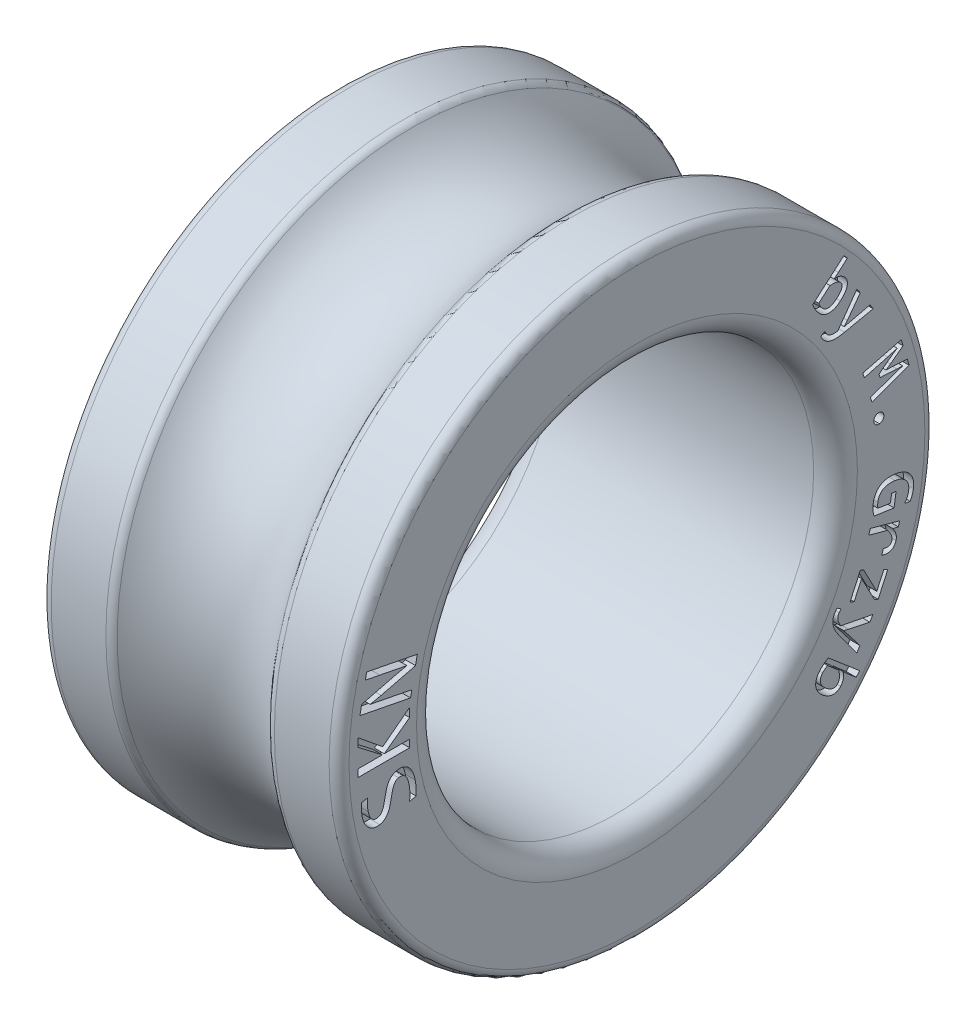
from build123d import *

# Parameters (mm, degrees)
FILLET1_R          = 1.1
FILLET2_R          = 0.5
FILLET3_R          = 0.5
CUT_EXTRUDE1_DEPTH = 0.5


with BuildPart() as part:
    # Sketch2 → Revolve1 (revolve)
    with BuildSketch(Plane(origin=(0, 0, 0), x_dir=(-1, 0, 0), z_dir=(0, 1, 0)), mode=Mode.PRIVATE) as revolve1_sk:
        with BuildLine():
            Line((-7.5, 15), (-7.5, 10))
            Line((-7.5, 10), (7.5, 10))
            Line((7.5, 10), (7.5, 15))
            Line((7.5, 15), (4, 15))
            ThreePointArc((4, 15), (0, 13), (-4, 15))
            Line((-4, 15), (-7.5, 15))
        make_face()
    revolve(revolve1_sk.sketch.rotate(Axis((14.358974359, 0, 0), (-1, 0, 0)), 180), axis=Axis((14.358974359, 0, 0), (-1, 0, 0)))

    # Fillet1
    fillet1_edges = [part.edges().sort_by_distance(p)[0] for p in [
        (-7.5, 0, 10),
        (7.5, 0, 10),
    ]]
    fillet(fillet1_edges, radius=FILLET1_R)

    # Fillet2
    fillet2_edges = [part.edges().sort_by_distance(p)[0] for p in [
        (-7.5, 0, 15),
        (7.5, 0, 15),
    ]]
    fillet(fillet2_edges, radius=FILLET2_R)

    # Fillet3
    fillet3_edges = [part.edges().sort_by_distance(p)[0] for p in [
        (4, 0, 15),
        (-4, 0, 15),
    ]]
    fillet(fillet3_edges, radius=FILLET3_R)

    # Sketch3 → Cut-Extrude1 (cut)
    # profile 1 of 12: a face of its own
    with BuildSketch(Plane.YZ.offset(7.5)):
        Polygon((3.076089788, 11.060643242), (2.623915875, 11.149547228), (2.191760078, 12.884646865), (2.078127831, 13.438088894), (1.826135078, 12.152808097), (1.66599015, 11.337364257), (1.342167686, 11.400951213), (1.842031817, 13.949728387), (2.288906817, 13.862001938), (2.701044498, 12.21757259), (2.842348846, 11.584646865), (3.110238338, 12.950000126), (3.252131454, 13.673007373), (3.575953918, 13.609420416), align=None)
    # profile 2 of 12: a face of its own
    with BuildSketch(Plane.YZ.offset(7.5)):
        Polygon((0.954928279, 11.446259467), (0.509819584, 11.446259467), (-0.432209402, 12.721531206), (-0.432209402, 11.446259467), (-0.809020996, 11.446259467), (-0.809020996, 14.046259467), (-0.432209402, 14.046259467), (-0.432209402, 12.819855481), (0.509819584, 14.046259467), (0.929022482, 14.046259467), (-0.08601375, 12.801603669), align=None)
    # profile 3 of 12: a face of its own
    with BuildSketch(Plane.YZ.offset(7.5)):
        with BuildLine():
            add(Edge.make_bspline(
                [(-1.479036237, 12.09199008), (-1.474231129, 12.062431483), (-1.464885598, 12.004942494), (-1.462556946, 11.919292862), (-1.47051932, 11.837274942), (-1.489843349, 11.759318587), (-1.517370348, 11.685222277), (-1.554434516, 11.615847461), (-1.599510651, 11.550698939), (-1.652728988, 11.489741424), (-1.714575897, 11.433830013), (-1.783894216, 11.381733355), (-1.8611857, 11.334127557), (-1.946060584, 11.291481292), (-2.037542379, 11.253104921), (-2.135331816, 11.220146202), (-2.238626546, 11.189910512), (-2.310253355, 11.175164605), (-2.34688044, 11.167624138)],
                knots=[0, 0, 0, 0, 1.005354078, 1.955329294, 2.870042248, 3.765730629, 4.646387396, 5.519580731, 6.401273885, 7.303276056, 8.2321656, 9.197602241, 10.213284686, 11.277945232, 12.386332483, 13.543757598, 14.743975884, 16, 16, 16, 16], degree=3))
            add(Edge.make_bspline(
                [(-2.34688044, 11.167624138), (-2.380791732, 11.161484778), (-2.448626962, 11.149203768), (-2.550210747, 11.135437133), (-2.649977204, 11.124932924), (-2.746174972, 11.117267459), (-2.838255235, 11.112398238), (-2.925237081, 11.110824798), (-3.005944515, 11.111048292), (-3.057332126, 11.113482475), (-3.081663049, 11.114635007)],
                knots=[0, 0, 0, 0, 1.120109665, 2.240637081, 3.33119982, 4.380705617, 5.377202028, 6.327927445, 7.208309769, 8, 8, 8, 8], degree=3))
            Line((-3.081663049, 11.114635007), (-3.147605078, 11.450232833))
            add(Edge.make_bspline(
                [(-3.147605078, 11.450232833), (-3.120953177, 11.44617891), (-3.066256165, 11.437859146), (-2.981865072, 11.431417692), (-2.893492717, 11.427814003), (-2.800968556, 11.427752188), (-2.703442174, 11.432204093), (-2.600865711, 11.44373943), (-2.492635058, 11.457589723), (-2.419232137, 11.471800396), (-2.381617759, 11.479082471)],
                knots=[0, 0, 0, 0, 0.839293667, 1.722460789, 2.63387489, 3.593446296, 4.603097706, 5.672247013, 6.807173082, 8, 8, 8, 8], degree=3))
            add(Edge.make_bspline(
                [(-2.381617759, 11.479082471), (-2.35468072, 11.484747057), (-2.302912411, 11.495633405), (-2.229104195, 11.514884759), (-2.162514049, 11.536679172), (-2.102416619, 11.560203199), (-2.048863594, 11.58597577), (-2.001153456, 11.613854976), (-1.959307723, 11.643545447), (-1.923457235, 11.675826428), (-1.893127864, 11.709691604), (-1.869433689, 11.746251138), (-1.850788527, 11.784076197), (-1.838283105, 11.82422948), (-1.831709823, 11.86606624), (-1.828360315, 11.909633298), (-1.830935044, 11.955076859), (-1.836119254, 11.98566086), (-1.838773556, 12.00131979)],
                knots=[0, 0, 0, 0, 1.543551753, 2.966438237, 4.275089847, 5.47069963, 6.583178451, 7.604368112, 8.566497703, 9.454922339, 10.304954346, 11.107790061, 11.890456177, 12.663231979, 13.455741403, 14.261062801, 15.109668579, 16, 16, 16, 16], degree=3))
            add(Edge.make_bspline(
                [(-1.838773556, 12.00131979), (-1.842514806, 12.017793625), (-1.849843966, 12.050066093), (-1.870325605, 12.09428083), (-1.896587648, 12.133849734), (-1.930223466, 12.167058608), (-1.968371325, 12.196796567), (-2.011015859, 12.222806426), (-2.05699635, 12.247646328), (-2.126352215, 12.274574255), (-2.220638225, 12.305998331), (-2.34342117, 12.331214562), (-2.472918765, 12.355285504), (-2.605826882, 12.380677719), (-2.739537056, 12.409179978), (-2.871262705, 12.441598524), (-2.997555149, 12.482369966), (-3.094819702, 12.529717355), (-3.166348713, 12.574283564), (-3.215271085, 12.613012908), (-3.260758032, 12.655374809), (-3.302563995, 12.702224774), (-3.339568227, 12.754749643), (-3.369361643, 12.814440044), (-3.393992814, 12.880082312), (-3.404299338, 12.926895413), (-3.409606889, 12.951002761)],
                knots=[0, 0, 0, 0, 0.617308121, 1.20931499, 1.773609048, 2.34806975, 2.931945175, 3.542349197, 4.175855008, 4.843366422, 6.264300034, 7.811379333, 9.428627203, 11.090947313, 12.767508624, 14.436174882, 16.059403867, 17.618811613, 18.384687985, 19.142593504, 19.900464926, 20.659290502, 21.43907723, 22.246093665, 23.096790682, 24, 24, 24, 24], degree=3))
            add(Edge.make_bspline(
                [(-3.409606889, 12.951002761), (-3.413240106, 12.972927221), (-3.42050441, 13.01676329), (-3.422536931, 13.083760182), (-3.417558201, 13.151338814), (-3.406670774, 13.219504157), (-3.387998363, 13.287230057), (-3.360501395, 13.353161169), (-3.324797741, 13.417029128), (-3.281196461, 13.47913589), (-3.228225962, 13.538348188), (-3.166152944, 13.594250783), (-3.094873446, 13.646584531), (-3.015062356, 13.696334652), (-2.925577518, 13.741938879), (-2.825094164, 13.780255557), (-2.715260826, 13.814187626), (-2.6376945, 13.830469144), (-2.597695658, 13.83886508)],
                knots=[0, 0, 0, 0, 0.790859942, 1.581256354, 2.380108088, 3.201785735, 4.036209735, 4.876120354, 5.739752446, 6.637697424, 7.573481636, 8.563291511, 9.607654368, 10.719108943, 11.910187897, 13.178437449, 14.544997031, 16, 16, 16, 16], degree=3))
            add(Edge.make_bspline(
                [(-2.597695658, 13.83886508), (-2.575357982, 13.84301495), (-2.528890287, 13.85164767), (-2.456302696, 13.86048739), (-2.380128864, 13.868018852), (-2.302012549, 13.87407383), (-2.22346152, 13.877379642), (-2.145926071, 13.879152287), (-2.071322334, 13.879323709), (-2.022859558, 13.877846713), (-1.999507252, 13.877135007)],
                knots=[0, 0, 0, 0, 0.907778726, 1.888396373, 2.920900302, 3.966988251, 5.019028008, 6.062436884, 7.0663645, 8, 8, 8, 8], degree=3))
            Line((-1.999507252, 13.877135007), (-1.938275368, 13.565087906))
            add(Edge.make_bspline(
                [(-1.938275368, 13.565087906), (-1.990849317, 13.568537075), (-2.095341242, 13.575392378), (-2.250551145, 13.573230775), (-2.401184758, 13.561735422), (-2.498683309, 13.545020137), (-2.546472832, 13.536827036)],
                knots=[0, 0, 0, 0, 1.034977525, 2.057041456, 3.047646745, 4, 4, 4, 4], degree=3))
            add(Edge.make_bspline(
                [(-2.546472832, 13.536827036), (-2.570458909, 13.531718486), (-2.616888169, 13.52182999), (-2.683441418, 13.50440757), (-2.744128842, 13.484356631), (-2.799462152, 13.462518434), (-2.849455377, 13.438683793), (-2.893968146, 13.412266052), (-2.932419903, 13.383173198), (-2.965782958, 13.35257613), (-2.993486564, 13.319903556), (-3.016921248, 13.286144172), (-3.035028369, 13.250802032), (-3.048926574, 13.21434136), (-3.057965491, 13.176540053), (-3.060986066, 13.137330135), (-3.060995366, 13.096968932), (-3.056355892, 13.070092402), (-3.053990947, 13.056392254)],
                knots=[0, 0, 0, 0, 1.49761663, 2.898899606, 4.198929802, 5.398561653, 6.529655968, 7.577962258, 8.553587863, 9.469521267, 10.336631543, 11.164414849, 11.973860158, 12.755221533, 13.543082541, 14.337389998, 15.152494596, 16, 16, 16, 16], degree=3))
            add(Edge.make_bspline(
                [(-3.053990947, 13.056392254), (-3.050012978, 13.039927432), (-3.042231672, 13.007720589), (-3.021738484, 12.963314207), (-2.995593746, 12.923329869), (-2.961966621, 12.88924287), (-2.923318637, 12.859618707), (-2.881211205, 12.831987591), (-2.834517172, 12.808348585), (-2.766121148, 12.778365537), (-2.670835648, 12.748910621), (-2.548138409, 12.721936827), (-2.418224173, 12.69850826), (-2.285204576, 12.67278335), (-2.151511609, 12.644789917), (-2.041348594, 12.616262209), (-1.954876455, 12.590618847), (-1.89321563, 12.56602844), (-1.834008224, 12.539171364), (-1.777993906, 12.508365815), (-1.724598948, 12.474382962), (-1.674939907, 12.435499918), (-1.629692386, 12.391469361), (-1.587313371, 12.343990004), (-1.550396878, 12.290398676), (-1.519545078, 12.230346986), (-1.495532257, 12.163535494), (-1.484632534, 12.116261955), (-1.479036237, 12.09199008)],
                knots=[0, 0, 0, 0, 0.666922642, 1.304567585, 1.918791052, 2.543084426, 3.182841637, 3.837926488, 4.52713315, 5.244976567, 6.782817839, 8.450870497, 10.200400576, 11.990869688, 13.79667786, 15.588402355, 16.479937145, 17.352780828, 18.205118492, 19.043733327, 19.872820386, 20.700024964, 21.526975804, 22.361038078, 23.20730418, 24.086956499, 25.017777067, 26, 26, 26, 26], degree=3))
        make_face()
    # profile 4 of 12: a face of its own
    with BuildSketch(Plane.YZ.offset(7.5)):
        with BuildLine():
            add(Edge.make_bspline(
                [(-8.888469786, -9.325566238), (-8.867822522, -9.302450582), (-8.827460027, -9.257262726), (-8.762659856, -9.196425103), (-8.695879745, -9.144105481), (-8.627640301, -9.099870162), (-8.558494592, -9.063643912), (-8.488679838, -9.035037304), (-8.418139497, -9.01510464), (-8.347260269, -9.002834281), (-8.276013283, -8.9979234), (-8.204768025, -9.002373773), (-8.13352165, -9.014125886), (-8.062608146, -9.034235586), (-7.992330562, -9.062602022), (-7.922654826, -9.098452037), (-7.85442928, -9.14303494), (-7.8116164, -9.178111974), (-7.789737902, -9.196037253)],
                knots=[0, 0, 0, 0, 1.188467682, 2.323287128, 3.404060307, 4.438462617, 5.438247551, 6.39420826, 7.327233931, 8.244017327, 9.149224409, 10.059860676, 10.975674289, 11.914271917, 12.880976054, 13.878091017, 14.915649195, 16, 16, 16, 16], degree=3))
            add(Edge.make_bspline(
                [(-7.789737902, -9.196037253), (-7.772674255, -9.210965184), (-7.738252045, -9.241079049), (-7.689011733, -9.289787411), (-7.640884129, -9.341272703), (-7.595045684, -9.39615965), (-7.550242259, -9.453071329), (-7.508876821, -9.51324594), (-7.470053814, -9.57591612), (-7.446814998, -9.619366762), (-7.435118337, -9.641236528)],
                knots=[0, 0, 0, 0, 0.949935675, 1.916289299, 2.901146672, 3.902389062, 4.912289178, 5.935439551, 6.960856474, 8, 8, 8, 8], degree=3))
            Line((-7.435118337, -9.641236528), (-8.777509641, -11.212794499))
            Line((-8.777509641, -11.212794499), (-8.979502395, -11.040240151))
            Line((-8.979502395, -11.040240151), (-8.593632829, -10.588700296))
            Line((-8.593632829, -10.588700296), (-8.39979225, -10.380819862))
            add(Edge.make_bspline(
                [(-8.39979225, -10.380819862), (-8.429884136, -10.386929983), (-8.487892082, -10.398708426), (-8.573318855, -10.404847366), (-8.653058878, -10.402289448), (-8.727272236, -10.389048936), (-8.796548802, -10.366258561), (-8.861997792, -10.336057287), (-8.924753923, -10.299152662), (-8.962647153, -10.268545754), (-8.981766887, -10.25310247)],
                knots=[0, 0, 0, 0, 1.186754452, 2.287699361, 3.304667345, 4.265773362, 5.192868662, 6.117938489, 7.050370874, 8, 8, 8, 8], degree=3))
            add(Edge.make_bspline(
                [(-8.981766887, -10.25310247), (-8.997565203, -10.238848876), (-9.028352085, -10.211072262), (-9.066840864, -10.163796575), (-9.098758088, -10.114694334), (-9.122423425, -10.062554345), (-9.138593494, -10.008232374), (-9.148758747, -9.952186153), (-9.151855527, -9.89438228), (-9.147961734, -9.835187935), (-9.138018339, -9.77459477), (-9.120837933, -9.712866001), (-9.097812852, -9.649717426), (-9.067468476, -9.585976442), (-9.031650666, -9.520977042), (-8.989582312, -9.455735339), (-8.941682996, -9.390042399), (-8.906512101, -9.347427336), (-8.888469786, -9.325566238)],
                knots=[0, 0, 0, 0, 0.972617281, 1.895382556, 2.780945736, 3.646743955, 4.50581576, 5.369211779, 6.248091163, 7.148067299, 8.079561543, 9.053454324, 10.07652809, 11.152265553, 12.281128319, 13.471424138, 14.702866093, 16, 16, 16, 16], degree=3))
        make_face()
        with BuildLine():
            add(Edge.make_bspline(
                [(-8.673795873, -9.492685804), (-8.698192994, -9.52246456), (-8.745182647, -9.579819418), (-8.795256058, -9.655629194), (-8.82827836, -9.714717511), (-8.847992123, -9.757248781), (-8.863455554, -9.798699148), (-8.874488995, -9.839164437), (-8.880979696, -9.878320312), (-8.882903692, -9.916324629), (-8.880191016, -9.953141473), (-8.873077913, -9.988727313), (-8.860710283, -10.022696079), (-8.842924038, -10.054834099), (-8.818805065, -10.084441972), (-8.79991782, -10.102199839), (-8.7901908, -10.111345224)],
                knots=[0, 0, 0, 0, 2.294896032, 4.420044701, 5.407390264, 6.329919037, 7.213027755, 8.042992118, 8.827513412, 9.575697517, 10.307004766, 11.023925705, 11.73317274, 12.454658845, 13.204142069, 14, 14, 14, 14], degree=3))
            add(Edge.make_bspline(
                [(-8.7901908, -10.111345224), (-8.776730761, -10.121722942), (-8.749345794, -10.142836808), (-8.701583902, -10.167578257), (-8.646640114, -10.185795353), (-8.583218906, -10.196847551), (-8.510612726, -10.200403117), (-8.444038045, -10.197547908), (-8.385484244, -10.191718026), (-8.337196045, -10.184730873), (-8.285654802, -10.176210226), (-8.250463857, -10.168985613), (-8.232219786, -10.165240151)],
                knots=[0, 0, 0, 0, 0.877292611, 1.784885566, 2.764633516, 3.859128106, 5.101965261, 6.515562194, 7.299863911, 8.143067262, 9.037308806, 10, 10, 10, 10], degree=3))
            Line((-8.232219786, -10.165240151), (-7.749429931, -9.60002276))
            add(Edge.make_bspline(
                [(-7.749429931, -9.60002276), (-7.763021205, -9.575733814), (-7.790062015, -9.527409222), (-7.838046558, -9.460792096), (-7.887706303, -9.398694774), (-7.926050291, -9.363773142), (-7.944629206, -9.34685247)],
                knots=[0, 0, 0, 0, 1.038471894, 2.066113899, 3.062968996, 4, 4, 4, 4], degree=3))
            add(Edge.make_bspline(
                [(-7.944629206, -9.34685247), (-7.956390575, -9.337269391), (-7.979650901, -9.318317043), (-8.017168853, -9.293995442), (-8.055715235, -9.272356479), (-8.096067915, -9.254841581), (-8.137686202, -9.240642654), (-8.181067008, -9.233337518), (-8.225574081, -9.230374677), (-8.271309006, -9.23336558), (-8.318467208, -9.241234601), (-8.36621589, -9.256907854), (-8.415523817, -9.277722967), (-8.465767516, -9.305687629), (-8.517394685, -9.340333517), (-8.569586566, -9.383200671), (-8.621975546, -9.434830639), (-8.656042263, -9.472864662), (-8.673795873, -9.492685804)],
                knots=[0, 0, 0, 0, 0.861035411, 1.702859944, 2.535641307, 3.368775692, 4.198461696, 5.025929639, 5.85919637, 6.726696229, 7.623201269, 8.566885821, 9.573371663, 10.659327884, 11.826934319, 13.10042467, 14.488908446, 16, 16, 16, 16], degree=3))
        make_face(mode=Mode.SUBTRACT)
    # profile 5 of 12: a face of its own
    with BuildSketch(Plane.YZ.offset(7.5)):
        with BuildLine():
            Line((-7.932062101, -11.071026213), (-6.748638188, -10.19693201))
            add(Edge.make_bspline(
                [(-6.748638188, -10.19693201), (-6.719020026, -10.175773177), (-6.661565581, -10.134728461), (-6.575980602, -10.07788716), (-6.49349925, -10.028101209), (-6.414478574, -9.984316386), (-6.338355716, -9.946537803), (-6.263701941, -9.916768336), (-6.191406418, -9.892732855), (-6.12055557, -9.876431564), (-6.051504559, -9.866149446), (-5.983829159, -9.862908554), (-5.917511515, -9.866539139), (-5.852360442, -9.876936303), (-5.787944446, -9.894731557), (-5.723313112, -9.91794755), (-5.659374648, -9.949686147), (-5.618021728, -9.974850299), (-5.596917174, -9.98769288)],
                knots=[0, 0, 0, 0, 1.387223393, 2.690989091, 3.914564467, 5.057971361, 6.133587738, 7.150738081, 8.118726475, 9.034286176, 9.917959616, 10.776204553, 11.611758001, 12.445109619, 13.28532526, 14.15540756, 15.058608164, 16, 16, 16, 16], degree=3))
            add(Edge.make_bspline(
                [(-5.596917174, -9.98769288), (-5.586281089, -9.994537016), (-5.56616814, -10.00747935), (-5.537658678, -10.028102993), (-5.509072213, -10.047834985), (-5.490287448, -10.061901951), (-5.480522246, -10.069214619)],
                knots=[0, 0, 0, 0, 1.067608886, 2.018859582, 2.970110278, 4, 4, 4, 4], degree=3))
            Line((-5.480522246, -10.069214619), (-5.611409927, -10.273018967))
            add(Edge.make_bspline(
                [(-5.611409927, -10.273018967), (-5.620420116, -10.265410976), (-5.639285629, -10.249481382), (-5.669580105, -10.225945889), (-5.701773164, -10.200397079), (-5.725542509, -10.185249008), (-5.737768623, -10.177457373)],
                knots=[0, 0, 0, 0, 0.89235037, 1.868401166, 2.90358056, 4, 4, 4, 4], degree=3))
            add(Edge.make_bspline(
                [(-5.737768623, -10.177457373), (-5.758258035, -10.165604544), (-5.798403074, -10.142381218), (-5.853194561, -10.123279203), (-5.897740141, -10.11503588), (-5.931959518, -10.110902438), (-5.967312725, -10.111941984), (-6.003801759, -10.11496491), (-6.04156993, -10.121309922), (-6.080636741, -10.131643079), (-6.121337437, -10.14449467), (-6.16312688, -10.161766441), (-6.206714276, -10.181426935), (-6.251619302, -10.205656221), (-6.299287222, -10.23177065), (-6.330736945, -10.252128572), (-6.346917174, -10.2626023)],
                knots=[0, 0, 0, 0, 1.514996234, 2.968342133, 3.687488783, 4.41723069, 5.171943309, 5.948901249, 6.763270276, 7.622114559, 8.536952921, 9.49634105, 10.518051183, 11.599966249, 12.765232469, 14, 14, 14, 14], degree=3))
            Line((-6.346917174, -10.2626023), (-6.661228768, -11.887149402))
            Line((-6.661228768, -11.887149402), (-6.916210652, -11.723653025))
            Line((-6.916210652, -11.723653025), (-6.693837464, -10.658435633))
            Line((-6.693837464, -10.658435633), (-6.630431667, -10.415229112))
            Line((-6.630431667, -10.415229112), (-6.837406304, -10.573290706))
            Line((-6.837406304, -10.573290706), (-7.686138188, -11.229087807))
            Line((-7.686138188, -11.229087807), (-7.932062101, -11.071026213))
        make_face()
    # profile 6 of 12: a face of its own
    with BuildSketch(Plane.YZ.offset(7.5)):
        Polygon((-5.539583362, -10.733649602), (-4.417300754, -11.247236559), (-4.496558, -11.420696704), (-5.748822493, -12.077399602), (-4.981612348, -12.428848878), (-5.074003652, -12.63129453), (-6.13106887, -12.147145979), (-6.044565246, -11.958287283), (-4.814492783, -11.312001052), (-5.632880464, -10.93745395), align=None)
    # profile 7 of 12: a face of its own
    with BuildSketch(Plane.YZ.offset(7.5)):
        with BuildLine():
            Line((-3.248763058, -13.225294846), (-3.482911609, -13.16143615))
            Line((-3.482911609, -13.16143615), (-3.415429725, -12.886979628))
            add(Edge.make_bspline(
                [(-3.415429725, -12.886979628), (-3.443642967, -12.906070004), (-3.497608219, -12.942585373), (-3.580377859, -12.98693082), (-3.65889159, -13.022260077), (-3.734930471, -13.045450902), (-3.807833713, -13.059550811), (-3.878414927, -13.064137303), (-3.947062306, -13.060071536), (-3.991010294, -13.050023682), (-4.012802913, -13.045041222)],
                knots=[0, 0, 0, 0, 1.279256544, 2.446914854, 3.524066501, 4.509225291, 5.427146246, 6.308288098, 7.161125794, 8, 8, 8, 8], degree=3))
            add(Edge.make_bspline(
                [(-4.012802913, -13.045041222), (-4.031340718, -13.039502602), (-4.067324808, -13.028751479), (-4.117848984, -13.007308222), (-4.163531621, -12.98228396), (-4.204768267, -12.953684285), (-4.240983959, -12.920989466), (-4.272783117, -12.8847738), (-4.299573356, -12.844739469), (-4.321445301, -12.800899791), (-4.338107354, -12.753557753), (-4.350025837, -12.702869211), (-4.356217887, -12.648628074), (-4.35685938, -12.59101582), (-4.352653233, -12.530155479), (-4.34348364, -12.465971375), (-4.328842612, -12.398395552), (-4.315756963, -12.352640111), (-4.308998565, -12.329008614)],
                knots=[0, 0, 0, 0, 1.044753591, 2.027991381, 2.958916226, 3.855026381, 4.732946556, 5.58852843, 6.452737719, 7.328229341, 8.228635634, 9.158559331, 10.135926182, 11.171982401, 12.267471115, 13.429108118, 14.672201105, 16, 16, 16, 16], degree=3))
            Line((-4.308998565, -12.329008614), (-4.049940594, -12.400113686))
            add(Edge.make_bspline(
                [(-4.049940594, -12.400113686), (-4.054297658, -12.415780387), (-4.062678453, -12.445915222), (-4.072743395, -12.490177395), (-4.080102312, -12.531562593), (-4.08438484, -12.570304355), (-4.085206534, -12.606193425), (-4.083759073, -12.639285718), (-4.078601728, -12.669620707), (-4.068796915, -12.705705301), (-4.049085189, -12.746134725), (-4.013807947, -12.785506892), (-3.96904968, -12.816874517), (-3.933819818, -12.828120211), (-3.915429725, -12.833990498)],
                knots=[0, 0, 0, 0, 1.131095061, 2.175656805, 3.156339143, 4.053995159, 4.883915354, 5.651708032, 6.354397847, 7.019429471, 8.249951985, 9.440430811, 10.663897183, 12, 12, 12, 12], degree=3))
            add(Edge.make_bspline(
                [(-3.915429725, -12.833990498), (-3.897847423, -12.837744028), (-3.862069488, -12.845382024), (-3.804964354, -12.845991936), (-3.744511762, -12.835897503), (-3.679690577, -12.815096905), (-3.609855475, -12.783741326), (-3.548721465, -12.749625207), (-3.49571254, -12.718301166), (-3.453619543, -12.689895004), (-3.408681935, -12.659661709), (-3.378810155, -12.637554389), (-3.363346391, -12.626110063)],
                knots=[0, 0, 0, 0, 0.883480663, 1.797780165, 2.791187763, 3.888988412, 5.140185976, 6.553700325, 7.333778147, 8.170701322, 9.053024511, 10, 10, 10, 10], degree=3))
            Line((-3.363346391, -12.626110063), (-3.103382623, -11.676834701))
            Line((-3.103382623, -11.676834701), (-2.844324652, -11.747486875))
            Line((-2.844324652, -11.747486875), (-3.248763058, -13.225294846))
        make_face()
    # profile 8 of 12: a face of its own
    with BuildSketch(Plane.YZ.offset(7.5)):
        with BuildLine():
            add(Edge.make_bspline(
                [(-2.618856113, -13.484750807), (-2.601776787, -13.497018722), (-2.56778538, -13.521434421), (-2.514850314, -13.554421167), (-2.46052928, -13.583804953), (-2.405330459, -13.611116552), (-2.347150525, -13.633589506), (-2.286366039, -13.653422595), (-2.222036907, -13.668518339), (-2.177925902, -13.676101737), (-2.155540895, -13.679950082)],
                knots=[0, 0, 0, 0, 0.993042256, 1.976360423, 2.943201891, 3.909491052, 4.882700715, 5.886158404, 6.927289077, 8, 8, 8, 8], degree=3))
            add(Edge.make_bspline(
                [(-2.155540895, -13.679950082), (-2.129919515, -13.683263523), (-2.079868312, -13.689736307), (-2.005592496, -13.689220439), (-1.934630195, -13.682416057), (-1.867157395, -13.667313369), (-1.803368447, -13.645006349), (-1.743595352, -13.615958782), (-1.687569791, -13.580730924), (-1.635819171, -13.538844023), (-1.588210165, -13.490516554), (-1.54451491, -13.436451607), (-1.505589439, -13.37616476), (-1.470672128, -13.310429845), (-1.440654438, -13.239230283), (-1.414489749, -13.163603749), (-1.394800699, -13.082986985), (-1.385419023, -13.02753909), (-1.380631475, -12.999243561)],
                knots=[0, 0, 0, 0, 1.063613668, 2.077762476, 3.05345057, 3.996885387, 4.919744257, 5.832459311, 6.730056373, 7.641498166, 8.569794029, 9.521074254, 10.501274864, 11.522745043, 12.584792564, 13.682684101, 14.817454096, 16, 16, 16, 16], degree=3))
            add(Edge.make_bspline(
                [(-1.380631475, -12.999243561), (-1.376690364, -12.969689363), (-1.369007981, -12.91207954), (-1.363072916, -12.827241862), (-1.362445468, -12.746448449), (-1.367350388, -12.669693378), (-1.377485898, -12.597209109), (-1.393631922, -12.529109954), (-1.416470201, -12.466092617), (-1.444395873, -12.407416063), (-1.479305203, -12.353999685), (-1.519927111, -12.305329478), (-1.567528963, -12.262235397), (-1.621115894, -12.224121554), (-1.681409096, -12.191287996), (-1.748635535, -12.164608366), (-1.82276705, -12.143804941), (-1.874946177, -12.134790718), (-1.901917707, -12.130131242)],
                knots=[0, 0, 0, 0, 1.234091966, 2.405608139, 3.518073827, 4.57650954, 5.586741639, 6.544742672, 7.467945432, 8.356811324, 9.228752071, 10.102572195, 10.974064874, 11.879302321, 12.819005814, 13.808948611, 14.867439676, 16, 16, 16, 16], degree=3))
            add(Edge.make_bspline(
                [(-1.901917707, -12.130131242), (-1.912020572, -12.128794561), (-1.932929636, -12.126028145), (-1.965168011, -12.12433001), (-1.998506167, -12.121939389), (-2.032204252, -12.122454458), (-2.065629276, -12.122820214), (-2.09772537, -12.126108018), (-2.127952544, -12.128508336), (-2.146960872, -12.132371514), (-2.155993794, -12.134207329)],
                knots=[0, 0, 0, 0, 0.958126896, 1.982955847, 3.035255606, 4.100220937, 5.151370432, 6.177280892, 7.133828197, 8, 8, 8, 8], degree=3))
            Line((-2.155993794, -12.134207329), (-2.248837997, -12.764189213))
            Line((-2.248837997, -12.764189213), (-1.84485249, -12.823971822))
            Line((-1.84485249, -12.823971822), (-1.877914084, -13.046797909))
            Line((-1.877914084, -13.046797909), (-2.548656837, -12.947613126))
            Line((-2.548656837, -12.947613126), (-2.399200316, -11.935837764))
            add(Edge.make_bspline(
                [(-2.399200316, -11.935837764), (-2.376788077, -11.929458082), (-2.331269977, -11.916501277), (-2.260567714, -11.903225608), (-2.188140048, -11.891866166), (-2.114425458, -11.886001024), (-2.040979097, -11.883000921), (-1.968416105, -11.884547735), (-1.897659765, -11.889299525), (-1.851320007, -11.895298984), (-1.828548142, -11.898247184)],
                knots=[0, 0, 0, 0, 0.970060632, 1.970143041, 2.993670812, 4.02236172, 5.047973285, 6.054204042, 7.043814511, 8, 8, 8, 8], degree=3))
            add(Edge.make_bspline(
                [(-1.828548142, -11.898247184), (-1.795665471, -11.9038543), (-1.731244047, -11.914839368), (-1.638734243, -11.940816806), (-1.552399019, -11.973952925), (-1.472487278, -12.014398518), (-1.398759107, -12.061224621), (-1.332600109, -12.115786994), (-1.273250351, -12.17653777), (-1.221957251, -12.244648192), (-1.177644322, -12.319143791), (-1.140806038, -12.400291228), (-1.112993392, -12.488769317), (-1.092221819, -12.583312634), (-1.079420089, -12.684559787), (-1.076350751, -12.791992229), (-1.081161367, -12.905710285), (-1.091095374, -12.982994493), (-1.096211185, -13.022794285)],
                knots=[0, 0, 0, 0, 1.049748317, 2.056593381, 3.019680091, 3.957170563, 4.872255732, 5.763904387, 6.651361925, 7.540269537, 8.441897387, 9.375826067, 10.339417063, 11.356666186, 12.420292152, 13.547501122, 14.73701307, 16, 16, 16, 16], degree=3))
            add(Edge.make_bspline(
                [(-1.096211185, -13.022794285), (-1.102794026, -13.062334928), (-1.115640517, -13.139498954), (-1.145574776, -13.25025598), (-1.181887458, -13.353908337), (-1.226944145, -13.449308582), (-1.277975823, -13.537065988), (-1.33535905, -13.616385664), (-1.398398014, -13.687515212), (-1.467591586, -13.749849381), (-1.542012615, -13.803468837), (-1.621601719, -13.848287513), (-1.706186322, -13.884231219), (-1.795704963, -13.910749941), (-1.889150757, -13.928743704), (-1.986305391, -13.935703253), (-2.086588139, -13.935636987), (-2.153933214, -13.927060969), (-2.188149591, -13.922703706)],
                knots=[0, 0, 0, 0, 1.204172083, 2.349955907, 3.443599505, 4.501178953, 5.515997248, 6.490808177, 7.438903646, 8.367425576, 9.284198181, 10.19035362, 11.107317105, 12.04045101, 12.991798439, 13.961378261, 14.964226425, 16, 16, 16, 16], degree=3))
            add(Edge.make_bspline(
                [(-2.188149591, -13.922703706), (-2.210068482, -13.919094978), (-2.25331618, -13.911974675), (-2.317060193, -13.898527598), (-2.378564603, -13.881461978), (-2.438474006, -13.86276861), (-2.496334726, -13.840526801), (-2.552088248, -13.814397547), (-2.606496492, -13.785822471), (-2.641040376, -13.763829056), (-2.658258287, -13.752866749)],
                knots=[0, 0, 0, 0, 1.057963274, 2.087444834, 3.100856563, 4.096850046, 5.07561712, 6.050361557, 7.028230267, 8, 8, 8, 8], degree=3))
            Line((-2.658258287, -13.752866749), (-2.618856113, -13.484750807))
        make_face()
    # profile 9 of 12: a face of its own
    with BuildSketch(Plane.YZ.offset(7.5)):
        with BuildLine():
            add(Edge.make_bspline(
                [(1.779107263, -12.430910787), (1.762189544, -12.432576609), (1.728483026, -12.435895558), (1.678437199, -12.427356311), (1.631440289, -12.410857052), (1.589240854, -12.385139196), (1.553161201, -12.351416706), (1.52305455, -12.311558991), (1.500616952, -12.265261448), (1.493681146, -12.231549716), (1.490157988, -12.21442528)],
                knots=[0, 0, 0, 0, 1.013365303, 2.019008306, 3.007829723, 3.98092352, 4.952758192, 5.946602592, 6.956942616, 8, 8, 8, 8], degree=3))
            add(Edge.make_bspline(
                [(1.490157988, -12.21442528), (1.488486729, -12.19750859), (1.485171672, -12.163953163), (1.493681597, -12.114181502), (1.51029445, -12.067777326), (1.535541836, -12.025719327), (1.569165216, -11.989957443), (1.608680942, -11.959832879), (1.653994756, -11.936809334), (1.687236024, -11.930168827), (1.703926103, -11.9268347)],
                knots=[0, 0, 0, 0, 1.022277578, 2.027758429, 3.01670331, 3.985835469, 4.966217166, 5.961525656, 6.976504216, 8, 8, 8, 8], degree=3))
            add(Edge.make_bspline(
                [(1.703926103, -11.9268347), (1.721305963, -11.925086261), (1.755359331, -11.921660441), (1.805468705, -11.930959079), (1.851982866, -11.947339994), (1.893654331, -11.972746891), (1.930068247, -12.005348438), (1.959690607, -12.044877092), (1.983011329, -12.089851278), (1.989569388, -12.122990943), (1.992875379, -12.139697019)],
                knots=[0, 0, 0, 0, 1.048495575, 2.054378315, 3.042298904, 4.010427292, 4.977527578, 5.971805185, 6.977564294, 8, 8, 8, 8], degree=3))
            add(Edge.make_bspline(
                [(1.992875379, -12.139697019), (1.994549448, -12.157065486), (1.997855979, -12.191370736), (1.989435458, -12.242055365), (1.972663867, -12.28916467), (1.947582621, -12.331602355), (1.91492458, -12.368491573), (1.875308019, -12.398386657), (1.829578424, -12.42100998), (1.796095217, -12.427578301), (1.779107263, -12.430910787)],
                knots=[0, 0, 0, 0, 1.039475837, 2.053115987, 3.041028338, 4.01632358, 4.981836865, 5.967561147, 6.968827039, 8, 8, 8, 8], degree=3))
        make_face()
    # profile 10 of 12: a face of its own
    with BuildSketch(Plane.YZ.offset(7.5)):
        Polygon((2.619746415, -11.831475686), (2.873369603, -11.753577135), (3.274637719, -12.93020757), (3.43043482, -13.381747425), (3.438134096, -13.089174961), (3.487500038, -12.244972063), (3.666847864, -12.190171338), (4.157789893, -12.837363367), (4.337137719, -13.104573512), (4.196739168, -12.625859744), (3.873822502, -11.447870614), (4.118387719, -11.373142353), (4.607518154, -13.307019164), (4.300000038, -13.401222063), (3.82445656, -12.762182208), (3.666847864, -12.545696701), (3.660960183, -12.812001048), (3.610688444, -13.611819889), (3.294112357, -13.70828728), align=None)
    # profile 11 of 12: a face of its own
    with BuildSketch(Plane.YZ.offset(7.5)):
        with BuildLine():
            Line((6.665643697, -11.895312616), (6.362654567, -10.456001022))
            add(Edge.make_bspline(
                [(6.362654567, -10.456001022), (6.355559882, -10.420275156), (6.341801918, -10.350995795), (6.326736477, -10.249378137), (6.315057965, -10.153664618), (6.308100617, -10.063457645), (6.30595581, -9.978314598), (6.309637375, -9.897977296), (6.317955631, -9.82224153), (6.331846696, -9.750912952), (6.352050121, -9.684214699), (6.376725367, -9.621160548), (6.40778019, -9.562523156), (6.444372185, -9.50761093), (6.486908296, -9.456073424), (6.53554978, -9.407512255), (6.590601461, -9.362078144), (6.630688246, -9.334907023), (6.651150944, -9.321037254)],
                knots=[0, 0, 0, 0, 1.387617387, 2.690858346, 3.913052682, 5.060978894, 6.136878051, 7.156049006, 8.122856157, 9.037738274, 9.920370897, 10.774890353, 11.613699817, 12.4432875, 13.285109139, 14.155530226, 15.058472097, 16, 16, 16, 16], degree=3))
            add(Edge.make_bspline(
                [(6.651150944, -9.321037254), (6.661841543, -9.314348976), (6.682058406, -9.301700853), (6.712290479, -9.283787415), (6.742497393, -9.266590925), (6.763148911, -9.255332818), (6.773886451, -9.249479283)],
                knots=[0, 0, 0, 0, 1.064874406, 2.013771049, 2.967281063, 4, 4, 4, 4], degree=3))
            Line((6.773886451, -9.249479283), (6.904774132, -9.453283631))
            add(Edge.make_bspline(
                [(6.904774132, -9.453283631), (6.894166524, -9.458184416), (6.871850115, -9.468494744), (6.838029103, -9.48617272), (6.80182148, -9.505389319), (6.778023404, -9.520308006), (6.765734277, -9.528011892)],
                knots=[0, 0, 0, 0, 0.887491425, 1.867114896, 2.898595983, 4, 4, 4, 4], degree=3))
            add(Edge.make_bspline(
                [(6.765734277, -9.528011892), (6.746379527, -9.541591929), (6.708380966, -9.568253182), (6.668103125, -9.610173972), (6.642171444, -9.647443443), (6.624394007, -9.677129259), (6.610422141, -9.709767662), (6.597886656, -9.74429346), (6.588469764, -9.781489303), (6.58134195, -9.821149927), (6.576404302, -9.863500973), (6.573646854, -9.908403271), (6.573721812, -9.956193817), (6.576715458, -10.007093552), (6.581476212, -10.061372698), (6.586808687, -10.098534652), (6.589556741, -10.117685805)],
                knots=[0, 0, 0, 0, 1.511976272, 2.968414605, 3.689913166, 4.417795369, 5.179494966, 5.959202126, 6.768146996, 7.632821922, 8.538153499, 9.496978187, 10.512050941, 11.596347782, 12.761294695, 14, 14, 14, 14], degree=3))
            Line((6.589556741, -10.117685805), (7.936477031, -11.079189428))
            Line((7.936477031, -11.079189428), (7.681495147, -11.242685805))
            Line((7.681495147, -11.242685805), (6.805136451, -10.597758269))
            Line((6.805136451, -10.597758269), (6.610390074, -10.438790877))
            Line((6.610390074, -10.438790877), (6.66790819, -10.692866964))
            Line((6.66790819, -10.692866964), (6.91156761, -11.737251022))
            Line((6.91156761, -11.737251022), (6.665643697, -11.895312616))
        make_face()
    # profile 12 of 12: a face of its own
    with BuildSketch(Plane.YZ.offset(7.5)):
        with BuildLine():
            add(Edge.make_bspline(
                [(7.829690942, -10.245556426), (7.809823922, -10.221551926), (7.771045735, -10.174697843), (7.720770445, -10.100963668), (7.678173098, -10.02712718), (7.644587289, -9.952554018), (7.619042354, -9.878258089), (7.601753362, -9.804492173), (7.591922573, -9.731530423), (7.59051839, -9.65919089), (7.597465716, -9.587829015), (7.611862384, -9.517559116), (7.634999779, -9.448778081), (7.665273277, -9.381062908), (7.703952707, -9.315379216), (7.750615062, -9.252043954), (7.805108577, -9.191102661), (7.846248045, -9.153712724), (7.867281521, -9.134596281)],
                knots=[0, 0, 0, 0, 1.188933386, 2.320664294, 3.402170095, 4.439056725, 5.437764973, 6.396706888, 7.32669059, 8.243166225, 9.152072965, 10.058528189, 10.975203115, 11.916704137, 12.885329273, 13.878919796, 14.915550152, 16, 16, 16, 16], degree=3))
            add(Edge.make_bspline(
                [(7.867281521, -9.134596281), (7.884807852, -9.119931839), (7.920121788, -9.090384347), (7.976037184, -9.048867951), (8.034354349, -9.008880825), (8.09555587, -8.971496174), (8.158880176, -8.935875589), (8.224848251, -8.903902231), (8.293112474, -8.875227304), (8.339724742, -8.85856802), (8.363205434, -8.850175991)],
                knots=[0, 0, 0, 0, 0.953327549, 1.920866771, 2.90451174, 3.902751676, 4.912256331, 5.934901529, 6.959717211, 8, 8, 8, 8], degree=3))
            Line((8.363205434, -8.850175991), (9.720542391, -10.421733962))
            Line((9.720542391, -10.421733962), (9.518549637, -10.596099904))
            Line((9.518549637, -10.596099904), (9.128603985, -10.144560049))
            Line((9.128603985, -10.144560049), (8.951520652, -9.920375266))
            add(Edge.make_bspline(
                [(8.951520652, -9.920375266), (8.953167015, -9.951327162), (8.956327363, -10.010742228), (8.949050133, -10.096704682), (8.934406852, -10.175581715), (8.909279124, -10.247197305), (8.876909398, -10.312729203), (8.836669219, -10.372824109), (8.790919606, -10.42970752), (8.754674212, -10.462641712), (8.73639384, -10.479252078)],
                knots=[0, 0, 0, 0, 1.191707883, 2.287595053, 3.312079692, 4.271323943, 5.1990397, 6.117666708, 7.050644855, 8, 8, 8, 8], degree=3))
            add(Edge.make_bspline(
                [(8.73639384, -10.479252078), (8.719772031, -10.49262808), (8.687464644, -10.518626676), (8.635088877, -10.550366616), (8.58120395, -10.574081711), (8.525646292, -10.589609978), (8.469318676, -10.597622178), (8.412119316, -10.599197339), (8.354422612, -10.592892501), (8.296103892, -10.580658764), (8.237273358, -10.56151564), (8.178673631, -10.534771488), (8.119230558, -10.502700634), (8.060537447, -10.4628681), (8.001925235, -10.417068229), (7.943166712, -10.365901869), (7.885809733, -10.308014778), (7.848689035, -10.266700673), (7.829690942, -10.245556426)],
                knots=[0, 0, 0, 0, 0.971592794, 1.88846014, 2.782001955, 3.646788686, 4.508916257, 5.369229805, 6.247622802, 7.147710412, 8.081157315, 9.060611884, 10.079789594, 11.156080867, 12.288779473, 13.468744731, 14.704522639, 16, 16, 16, 16], degree=3))
        make_face()
        with BuildLine():
            add(Edge.make_bspline(
                [(8.028060507, -10.057603527), (8.054040142, -10.086250739), (8.104004252, -10.14134514), (8.171158795, -10.203151101), (8.225213042, -10.244423278), (8.264478627, -10.270573609), (8.303109923, -10.292367615), (8.341612996, -10.309444561), (8.379585895, -10.321670415), (8.417075469, -10.32956079), (8.454032635, -10.332887562), (8.490511205, -10.331192243), (8.526124979, -10.323891958), (8.560654028, -10.310945249), (8.594149246, -10.292190952), (8.614488908, -10.275767388), (8.624980797, -10.267295556)],
                knots=[0, 0, 0, 0, 2.294631021, 4.413040997, 5.40398084, 6.328367428, 7.210769807, 8.033136964, 8.823651957, 9.573948114, 10.302367562, 11.020018044, 11.733405439, 12.450664327, 13.200799988, 14, 14, 14, 14], degree=3))
            add(Edge.make_bspline(
                [(8.624980797, -10.267295556), (8.637314382, -10.255581387), (8.662528023, -10.231634024), (8.693710123, -10.187437244), (8.721232473, -10.136119882), (8.741018377, -10.074567329), (8.755876844, -10.003256401), (8.762853715, -9.936677686), (8.765627845, -9.877676713), (8.766605963, -9.828589106), (8.765669396, -9.776018895), (8.763686802, -9.739814655), (8.762661956, -9.721099904)],
                knots=[0, 0, 0, 0, 0.873123668, 1.784933313, 2.768002455, 3.858368757, 5.096639255, 6.51080025, 7.296104484, 8.134952449, 9.035916733, 10, 10, 10, 10], degree=3))
            Line((8.762661956, -9.721099904), (8.274890217, -9.155882512))
            add(Edge.make_bspline(
                [(8.274890217, -9.155882512), (8.248878077, -9.165694262), (8.196821558, -9.185329922), (8.123273352, -9.222466008), (8.0545263, -9.263187605), (8.013850411, -9.295521389), (7.994093115, -9.311226715)],
                knots=[0, 0, 0, 0, 1.033701362, 2.068683946, 3.061911513, 4, 4, 4, 4], degree=3))
            add(Edge.make_bspline(
                [(7.994093115, -9.311226715), (7.982934395, -9.32149779), (7.960768386, -9.341900553), (7.930175482, -9.374871837), (7.903675835, -9.410626079), (7.879183634, -9.447438188), (7.859729669, -9.486992575), (7.845013853, -9.528625375), (7.835592817, -9.572446108), (7.830874169, -9.618337346), (7.83249351, -9.666398356), (7.839793261, -9.716560022), (7.853765439, -9.768635685), (7.87330415, -9.823082754), (7.900284803, -9.879370712), (7.935180169, -9.937569794), (7.977770744, -9.997921783), (8.010840203, -10.037167206), (8.028060507, -10.057603527)],
                knots=[0, 0, 0, 0, 0.856786383, 1.70194551, 2.536144116, 3.368946133, 4.196709715, 5.019492433, 5.857693266, 6.723391767, 7.619361755, 8.567487462, 9.581214898, 10.660466341, 11.831753205, 13.101484578, 14.490652251, 16, 16, 16, 16], degree=3))
        make_face(mode=Mode.SUBTRACT)
    extrude(amount=-CUT_EXTRUDE1_DEPTH, mode=Mode.SUBTRACT)


solid = part.part
